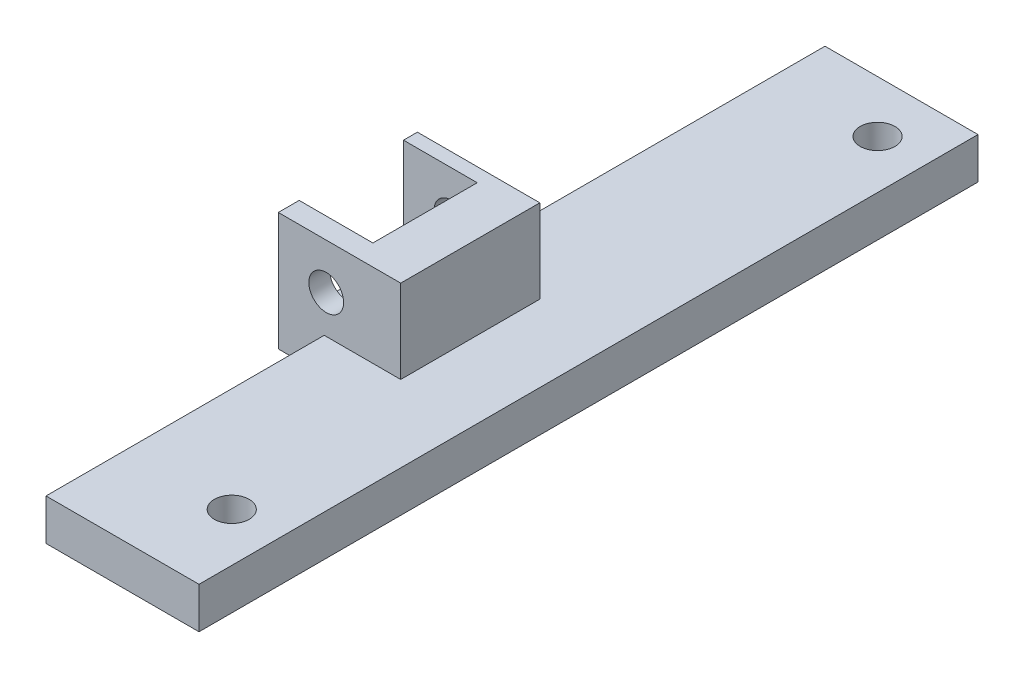
from build123d import *

# Parameters (mm, degrees)
BOSS_EXTRUDE1_DEPTH      = 21.59
SKETCH2_W                = 22.352
SKETCH2_H                = 21.59
SKETCH2_R                = 3.175
BOSS_EXTRUDE2_DEPTH      = 3.81
BOSS_EXTRUDE3_START      = -2.54
SKETCH3_R                = 3.175
BOSS_EXTRUDE3_DEPTH      = 2.54
BOSS_EXTRUDE4_DEPTH      = 1.164777
BOSS_EXTRUDE4_DEPTH_BACK = 6.35
SKETCH4_W                = 27.94
SKETCH4_H                = 142.24
SKETCH4_R                = 3.175


with BuildPart() as part:
    # Sketch1 → Boss-Extrude1 (new body)
    with BuildSketch(Plane.XY):
        with BuildLine():
            Line((801.338321143, 96.160777143), (792.583825879, 96.160777143))
            Line((792.583825879, 96.160777143), (792.583825879, 92.376177143))
            Line((792.583825879, 92.376177143), (814.935825879, 92.376177143))
            Line((814.935825879, 92.376177143), (814.935825879, 113.966177143))
            Line((814.935825879, 113.966177143), (806.045825879, 113.966177143))
            ThreePointArc((806.045825879, 113.966177143), (810.863321143, 105.685777143), (806.045825879, 97.405377143))
            ThreePointArc((806.045825879, 97.405377143), (803.772947911, 96.477182381), (801.338321143, 96.160777143))
        make_face()
    extrude(amount=-BOSS_EXTRUDE1_DEPTH)

    # Sketch2 → Boss-Extrude2 (add)
    with BuildSketch(Plane.XY):
        with Locations((803.759825879, 103.171177143)):
            Rectangle(SKETCH2_W, SKETCH2_H)
        with Locations((801.338321143, 105.685777143)):
            Circle(SKETCH2_R, mode=Mode.SUBTRACT)
    extrude(amount=BOSS_EXTRUDE2_DEPTH)

    # Sketch3 → Boss-Extrude3 (add)
    with BuildSketch(Plane(origin=(0, 0, -21.59), x_dir=(-1, 0, 0), z_dir=(0, 0, -1)).offset(BOSS_EXTRUDE3_START)):
        with BuildLine():
            Line((-801.338321143, 96.160777143), (-792.583825879, 96.160777143))
            Line((-792.583825879, 96.160777143), (-792.583825879, 113.966177143))
            Line((-792.583825879, 113.966177143), (-806.045825879, 113.966177143))
            ThreePointArc((-806.045825879, 113.966177143), (-810.546915906, 103.251150375), (-801.338321143, 96.160777143))
        make_face()
        with Locations(Location((-801.338321143, 105.685777143, 0), (0, 0, 180))):
            Circle(SKETCH3_R, mode=Mode.SUBTRACT)
    extrude(amount=BOSS_EXTRUDE3_DEPTH)

    # Sketch4 → Boss-Extrude4 (add, two sides: drawn at the far end of the back side and taken through both)
    with BuildSketch(Plane.XZ.offset(-92.376177143).offset(-BOSS_EXTRUDE4_DEPTH_BACK)):
        with Locations((814.935825879, -16.51)):
            Rectangle(SKETCH4_W, SKETCH4_H)
        with Locations(Location((820.039, 39.768571429, 0), (0, 0, 270))):
            Circle(SKETCH4_R, mode=Mode.SUBTRACT)
        with Locations(Location((820.039, -78.16, 0), (0, 0, 270))):
            Circle(SKETCH4_R, mode=Mode.SUBTRACT)
    extrude(amount=BOSS_EXTRUDE4_DEPTH + BOSS_EXTRUDE4_DEPTH_BACK)


solid = part.part
